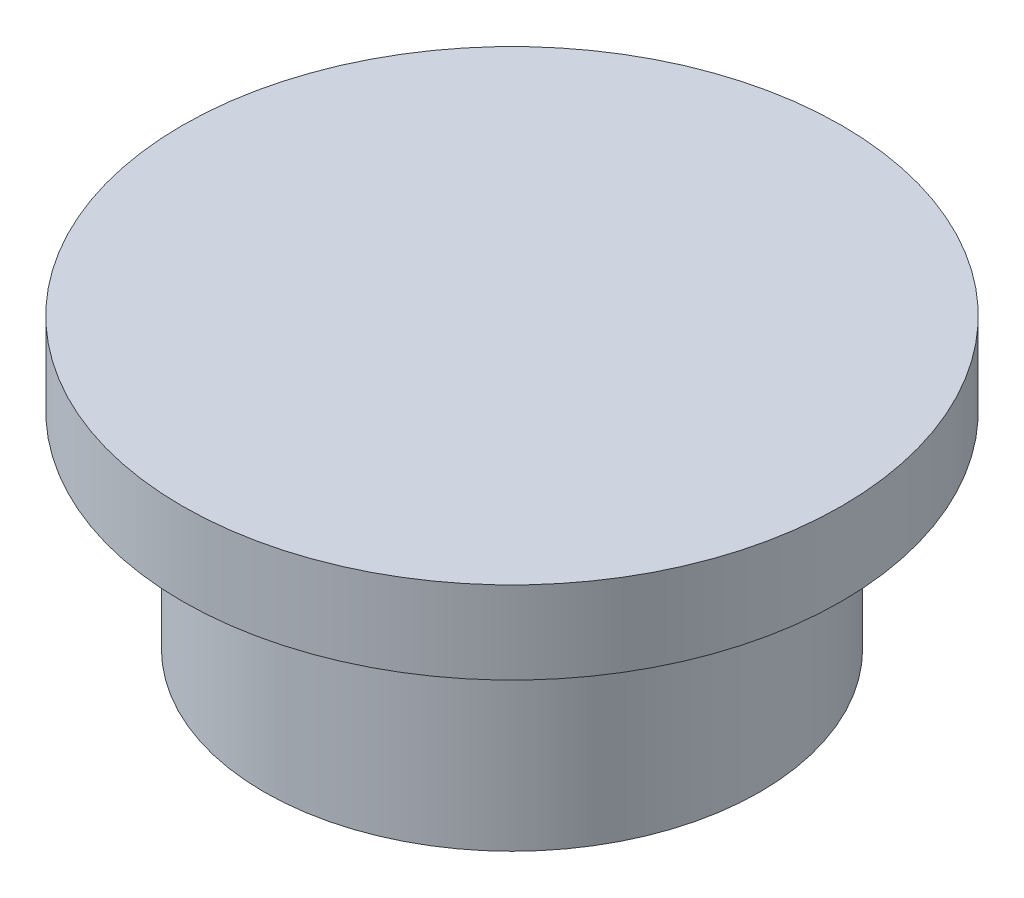
from build123d import *


with BuildPart() as part:
    # Sketch1 → Revolve1 (revolve)
    with BuildSketch(Plane.XY, mode=Mode.PRIVATE) as revolve1_sk:
        Polygon((0, 0), (3.175, 0), (3.175, -0.79375), (2.3876, -0.79375), (2.3876, -2.778125), (0, -2.778125), align=None)
    revolve(revolve1_sk.sketch.rotate(Axis((0, 1.488656027, 0), (0, 1, 0)), 90), axis=Axis((0, 1.488656027, 0), (0, 1, 0)))


solid = part.part
